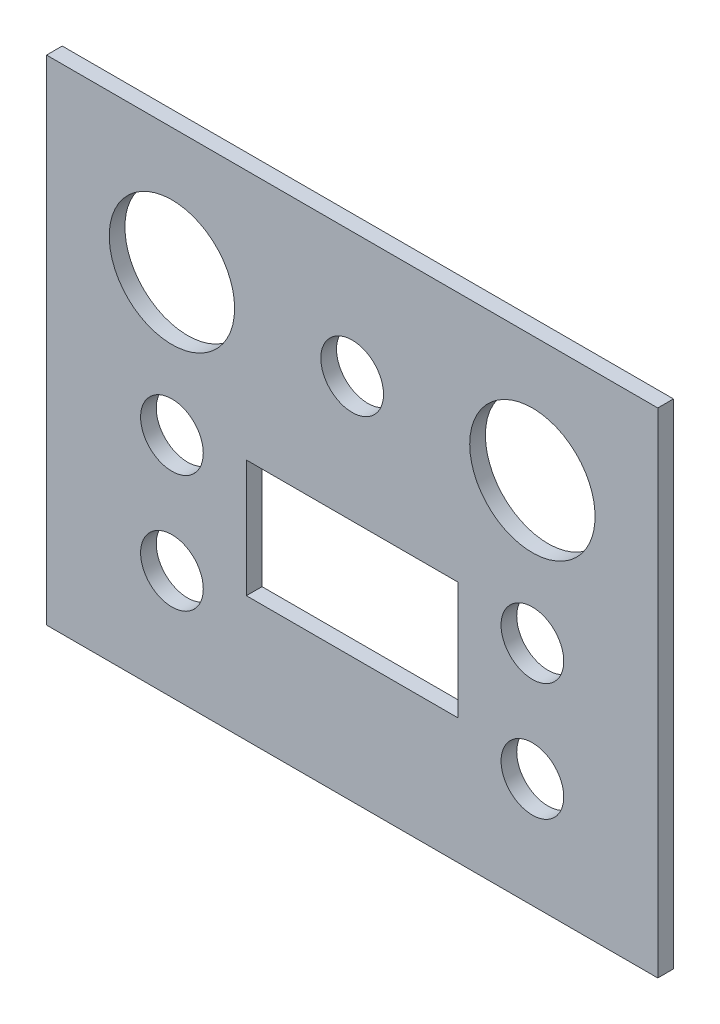
from build123d import *

# Parameters (mm, degrees)
SKETCH1_W           = 78
SKETCH1_H           = 63
SKETCH1_R           = 8
SKETCH1_R_2         = 4
SKETCH1_W_2         = 27
SKETCH1_H_2         = 15
BOSS_EXTRUDE1_DEPTH = 2


with BuildPart() as part:
    # Sketch1 → Boss-Extrude1 (new body)
    with BuildSketch(Plane.XY):
        Rectangle(SKETCH1_W, SKETCH1_H)
        with Locations(Location((23, 15.5, 0), (0, 0, 180))):
            Circle(SKETCH1_R, mode=Mode.SUBTRACT)
        with Locations((0, 15.5)):
            Circle(SKETCH1_R_2, mode=Mode.SUBTRACT)
        with Locations((-23, -17.5)):
            Circle(SKETCH1_R_2, mode=Mode.SUBTRACT)
        with Locations(Location((23, -2.5, 0), (0, 0, 180))):
            Circle(SKETCH1_R_2, mode=Mode.SUBTRACT)
        with Locations(Location((23, -17.5, 0), (0, 0, 180))):
            Circle(SKETCH1_R_2, mode=Mode.SUBTRACT)
        with Locations((-23, -2.5)):
            Circle(SKETCH1_R_2, mode=Mode.SUBTRACT)
        with Locations((-23, 15.5)):
            Circle(SKETCH1_R, mode=Mode.SUBTRACT)
        with Locations((0, -8)):
            Rectangle(SKETCH1_W_2, SKETCH1_H_2, mode=Mode.SUBTRACT)
    extrude(amount=BOSS_EXTRUDE1_DEPTH)


solid = part.part
